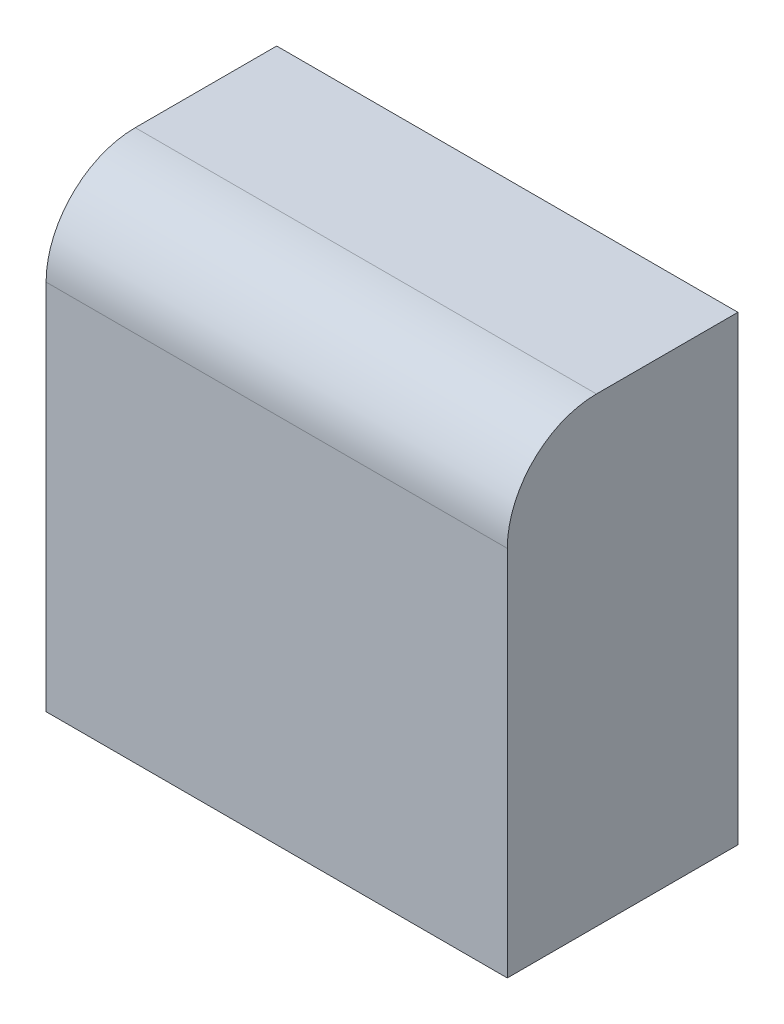
from build123d import *

# Parameters (mm, degrees)
ESQUISSE1_W        = 15.52
ESQUISSE1_H        = 15.52
BOSS_EXTRU_1_DEPTH = 7.76
CONG_1_R           = 3


with BuildPart() as part:
    # Esquisse1 → Boss.-Extru.1 (new body)
    with BuildSketch(Plane.XY):
        Rectangle(ESQUISSE1_W, ESQUISSE1_H)
    extrude(amount=BOSS_EXTRU_1_DEPTH)

    # Congé1
    cong_1_edges = [part.edges().sort_by_distance(p)[0] for p in [
        (0, 7.76, 7.76),
    ]]
    fillet(cong_1_edges, radius=CONG_1_R)


solid = part.part
